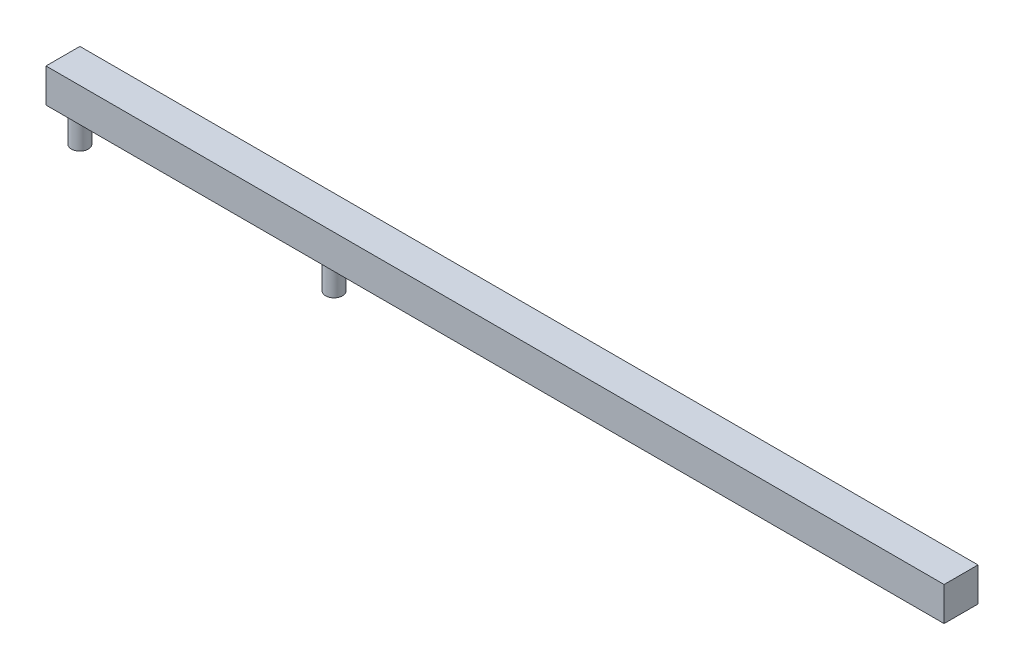
from build123d import *

# Parameters (mm, degrees)
ESQUISSE1_W        = 265
ESQUISSE1_H        = 10
BOSS_EXTRU_1_DEPTH = 10
ESQUISSE2_R        = 2.5
BOSS_EXTRU_2_DEPTH = 10


with BuildPart() as part:
    # Esquisse1 → Boss.-Extru.1 (new body)
    with BuildSketch(Plane(origin=(0, 0, 0), x_dir=(1, 0, 0), z_dir=(0, 1, 0))):
        with Locations((-132.5, -5)):
            Rectangle(ESQUISSE1_W, ESQUISSE1_H)
    extrude(amount=BOSS_EXTRU_1_DEPTH)

    # Esquisse2 → Boss.-Extru.2 (add)
    with BuildSketch(Plane(origin=(0, 0, 0), x_dir=(-1, 0, 0), z_dir=(0, -1, 0))):
        with Locations(Location((260, -5, 0), (0, 0, 90))):
            Circle(ESQUISSE2_R)
        with Locations(Location((185, -5, 0), (0, 0, 90))):
            Circle(ESQUISSE2_R)
    extrude(amount=BOSS_EXTRU_2_DEPTH)


solid = part.part
